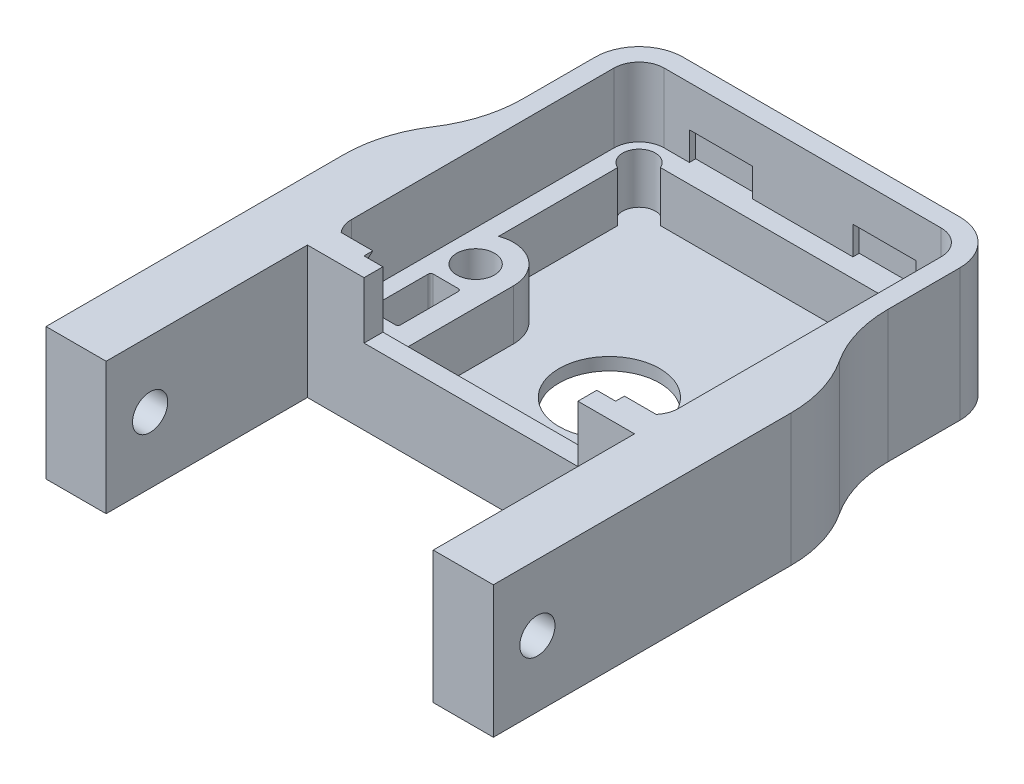
from build123d import *

# Parameters (mm, degrees)
BOSS_EXTRUDE1_DEPTH     = 9.5
BOSS_EXTRUDE2_START     = 1
BOSS_EXTRUDE2_DEPTH     = 1
CUT_EXTRUDE1_DEPTH      = 40.261368341
CUT_EXTRUDE1_DEPTH_BACK = 40.261368341
SKETCH4_R               = 4
SKETCH5_R               = 1.5
BOSS_EXTRUDE3_DEPTH     = 4
CUT_EXTRUDE2_DEPTH      = 41.283880697
CUT_EXTRUDE2_DEPTH_BACK = 3
SKETCH6_W               = 17
SKETCH6_H               = 4.5
BOSS_EXTRUDE4_DEPTH     = 10.5
CUT_EXTRUDE3_DEPTH      = 46.272780922
CUT_EXTRUDE3_DEPTH_BACK = 46.272780922
SKETCH9_R               = 1.4
FILLET1_R               = 10
BOSS_EXTRUDE6_DEPTH     = 3
SKETCH14_W              = 5
SKETCH14_H              = 2.25
CUT_EXTRUDE4_DEPTH      = 0.5


with BuildPart() as part:
    # Sketch1 → Boss-Extrude1 (new body)
    with BuildSketch(Plane(origin=(0, 0, 0), x_dir=(1, 0, 0), z_dir=(0, 1, 0))):
        with BuildLine():
            Line((-1.5, 2), (-1.5, 22.862))
            ThreePointArc((-1.5, 22.862), (-0.474873734, 25.336873734), (2, 26.362))
            Line((2, 26.362), (24, 26.362))
            ThreePointArc((24, 26.362), (26.474873734, 25.336873734), (27.5, 22.862))
            Line((27.5, 22.862), (27.5, 2))
            Line((27.5, 2), (27.5, -1.5))
            Line((27.5, -1.5), (24, -1.5))
            Line((24, -1.5), (2, -1.5))
            Line((2, -1.5), (-1.5, -1.5))
            Line((-1.5, -1.5), (-1.5, 2))
        make_face()
        with BuildLine():
            Line((2, 0), (24, 0))
            ThreePointArc((24, 0), (25.414213562, 0.585786438), (26, 2))
            Line((26, 2), (26, 22.862))
            ThreePointArc((26, 22.862), (25.414213562, 24.276213562), (24, 24.862))
            Line((24, 24.862), (2, 24.862))
            ThreePointArc((2, 24.862), (0.585786438, 24.276213562), (0, 22.862))
            Line((0, 22.862), (0, 2))
            ThreePointArc((0, 2), (0.585786438, 0.585786438), (2, 0))
        make_face(mode=Mode.SUBTRACT)
    extrude(amount=BOSS_EXTRUDE1_DEPTH)

    # Sketch3 → Boss-Extrude2 (add)
    with BuildSketch(Plane.XZ.offset(BOSS_EXTRUDE2_START)):
        with BuildLine():
            Line((24, -26.362), (2, -26.362))
            ThreePointArc((2, -26.362), (-0.474873734, -25.336873734), (-1.5, -22.862))
            Line((-1.5, -22.862), (-1.5, 1.5))
            Line((-1.5, 1.5), (27.5, 1.5))
            Line((27.5, 1.5), (27.5, -22.862))
            ThreePointArc((27.5, -22.862), (26.474873734, -25.336873734), (24, -26.362))
        make_face()
    extrude(amount=-BOSS_EXTRUDE2_DEPTH)

    # Sketch4 → Cut-Extrude1 (cut, two sides: drawn at the far end of the back side and taken through both)
    with BuildSketch(Plane(origin=(0, 0, 0), x_dir=(1, 0, 0), z_dir=(0, 1, 0)).offset(-CUT_EXTRUDE1_DEPTH_BACK)):
        with Locations(Location((13, 9.5, 0), (0, 0, 270))):
            Circle(SKETCH4_R)
    extrude(amount=CUT_EXTRUDE1_DEPTH + CUT_EXTRUDE1_DEPTH_BACK, mode=Mode.SUBTRACT)

    # Sketch5 → Boss-Extrude3 (add)
    with BuildSketch(Plane(origin=(0, 0, 0), x_dir=(1, 0, 0), z_dir=(0, 1, 0))):
        with BuildLine():
            Line((3.2, 23.362), (22.866091564, 23.362))
            ThreePointArc((22.866091564, 23.362), (24.876284298, 23.738284298), (24.5, 21.728091564))
            Line((24.5, 21.728091564), (24.5, 12.199689562))
            ThreePointArc((24.5, 12.199689562), (21.767949192, 11.82075218), (20.5, 9.371262437))
            Line((20.5, 9.371262437), (20.5, 0))
            Line((20.5, 0), (24, 0))
            ThreePointArc((24, 0), (25.414213562, 0.585786438), (26, 2))
            Line((26, 2), (26, 22.862))
            ThreePointArc((26, 22.862), (25.414213562, 24.276213562), (24, 24.862))
            Line((24, 24.862), (2, 24.862))
            ThreePointArc((2, 24.862), (0.585786438, 24.276213562), (0, 22.862))
            Line((0, 22.862), (0, 2))
            ThreePointArc((0, 2), (0.585786438, 0.585786438), (2, 0))
            Line((2, 0), (5.5, 0))
            Line((5.5, 0), (5.5, 9.371262437))
            ThreePointArc((5.5, 9.371262437), (4.232050808, 11.82075218), (1.5, 12.199689562))
            Line((1.5, 12.199689562), (1.5, 21.662))
            ThreePointArc((1.5, 21.662), (1.080761184, 23.781238816), (3.2, 23.362))
        make_face()
        with BuildLine():
            Line((3.5, 2), (1.5, 2))
            ThreePointArc((1.5, 2), (1.358578644, 2.058578644), (1.3, 2.2))
            Line((1.3, 2.2), (1.3, 6.8))
            ThreePointArc((1.3, 6.8), (1.358578644, 6.941421356), (1.5, 7))
            Line((1.5, 7), (3.5, 7))
            ThreePointArc((3.5, 7), (3.641421356, 6.941421356), (3.7, 6.8))
            Line((3.7, 6.8), (3.7, 2.2))
            ThreePointArc((3.7, 2.2), (3.641421356, 2.058578644), (3.5, 2))
        make_face(mode=Mode.SUBTRACT)
        with Locations(Location((2.5, 9.371262437, 0), (0, 0, 270))):
            Circle(SKETCH5_R, mode=Mode.SUBTRACT)
        with BuildLine():
            ThreePointArc((22.5, 2), (22.358578644, 2.058578644), (22.3, 2.2))
            Line((22.3, 2.2), (22.3, 6.8))
            ThreePointArc((22.3, 6.8), (22.358578644, 6.941421356), (22.5, 7))
            Line((22.5, 7), (24.5, 7))
            ThreePointArc((24.5, 7), (24.641421356, 6.941421356), (24.7, 6.8))
            Line((24.7, 6.8), (24.7, 2.2))
            ThreePointArc((24.7, 2.2), (24.641421356, 2.058578644), (24.5, 2))
            Line((24.5, 2), (22.5, 2))
        make_face(mode=Mode.SUBTRACT)
        with Locations(Location((23.5, 9.371262437, 0), (0, 0, 90))):
            Circle(SKETCH5_R, mode=Mode.SUBTRACT)
    extrude(amount=BOSS_EXTRUDE3_DEPTH)

    # Sketch6 → Cut-Extrude2 (cut, two sides: drawn at the far end of the back side and taken through both)
    with BuildSketch(Plane.XY.offset(1.5).offset(-CUT_EXTRUDE2_DEPTH_BACK)):
        with Locations((13, 7.25)):
            Rectangle(SKETCH6_W, SKETCH6_H)
    extrude(amount=CUT_EXTRUDE2_DEPTH + CUT_EXTRUDE2_DEPTH_BACK, mode=Mode.SUBTRACT)

    # Sketch7 → Boss-Extrude4 (add)
    with BuildSketch(Plane.XZ.offset(1)):
        Polygon((27.5, -14.163598373), (30.779339473, -9.127595345), (30.779339473, 17.5), (26, 17.5), (26, 1.5), (27.5, 1.5), align=None)
    boss_extrude4 = extrude(amount=-BOSS_EXTRUDE4_DEPTH)

    # Mirror1: Boss-Extrude4 across plane
    add(boss_extrude4.mirror(Plane(origin=(13, 0, 0), x_dir=(0, 0, 1), z_dir=(1, 0, 0))))

    # Sketch9 → Cut-Extrude3 (cut, two sides: drawn at the far end of the back side and taken through both)
    with BuildSketch(Plane.ZY.offset(4.779339473).offset(-CUT_EXTRUDE3_DEPTH_BACK)):
        with Locations((14, 4.25)):
            Circle(SKETCH9_R)
    extrude(amount=CUT_EXTRUDE3_DEPTH + CUT_EXTRUDE3_DEPTH_BACK, mode=Mode.SUBTRACT)

    # Fillet1
    fillet1_edges = [part.edges().sort_by_distance(p)[0] for p in [
        (30.779339473, 4.25, -9.127595345),
        (27.5, 4.25, -14.163598373),
        (-1.5, 4.25, -14.163598373),
        (-4.779339473, 4.25, -9.127595345),
    ]]
    fillet(fillet1_edges, radius=FILLET1_R)

    # Sketch13 → Boss-Extrude6 (add)
    with BuildSketch(Plane(origin=(0, 0, 0), x_dir=(0, 0, -1), z_dir=(1, 0, 0))):
        Polygon((0, 9.5), (0.7, 9.5), (0, 8.9), align=None)
    boss_extrude6 = extrude(amount=BOSS_EXTRUDE6_DEPTH)

    # Sketch14 → Cut-Extrude4 (cut)
    with BuildSketch(Plane.XY.offset(-24.862)):
        with Locations((6.5, 5.125)):
            Rectangle(SKETCH14_W, SKETCH14_H)
    cut_extrude4 = extrude(amount=-CUT_EXTRUDE4_DEPTH, mode=Mode.SUBTRACT)

    # Mirror3: Boss-Extrude6, Cut-Extrude4 across plane
    add(boss_extrude6.mirror(Plane(origin=(13, 0, 0), x_dir=(0, 0, 1), z_dir=(1, 0, 0))))
    add(cut_extrude4.mirror(Plane(origin=(13, 0, 0), x_dir=(0, 0, 1), z_dir=(1, 0, 0))), mode=Mode.SUBTRACT)


solid = part.part
